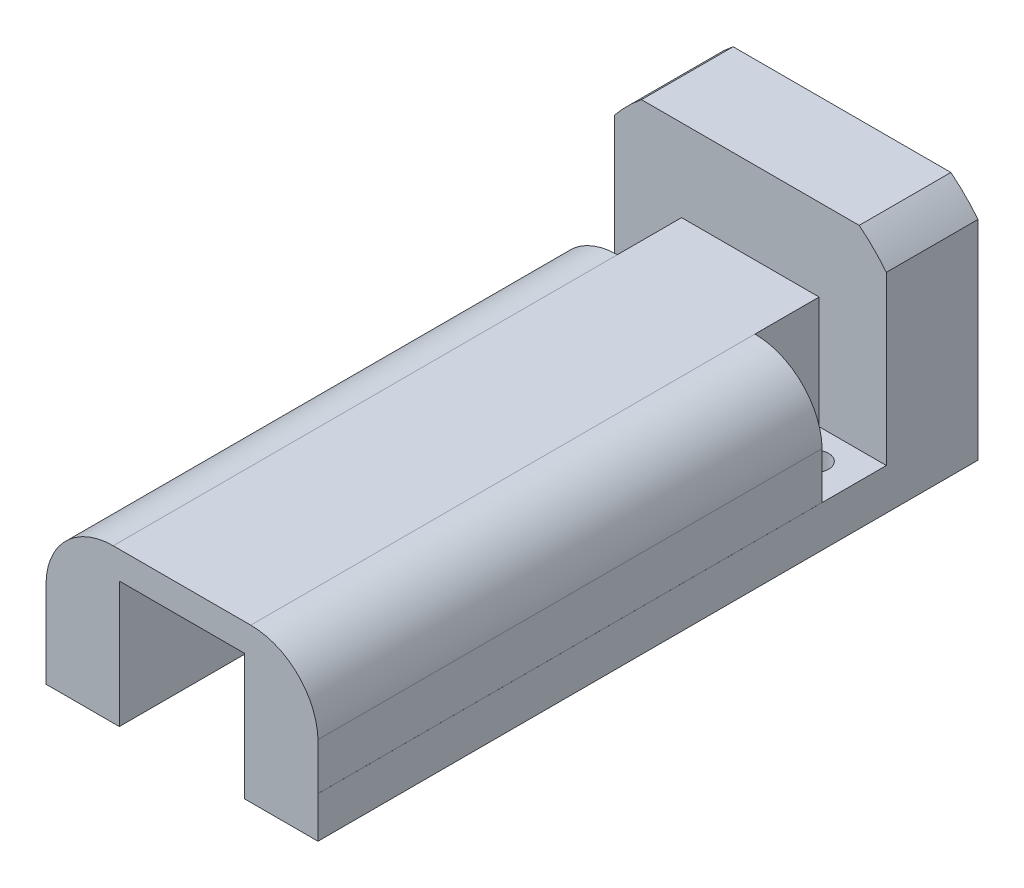
from build123d import *

# Parameters (mm, degrees)
BOSS_EXTRUDE1_DEPTH = 72
BOSS_EXTRUDE3_DEPTH = 5
CUT_EXTRUDE4_DEPTH  = 5
BOSS_EXTRUDE4_DEPTH = 5
BOSS_EXTRUDE5_START = 7
BOSS_EXTRUDE5_DEPTH = 55
CUT_EXTRUDE8_DEPTH  = 5
SKETCH19_W          = 15
SKETCH19_H          = 12.25
BOSS_EXTRUDE8_DEPTH = 7
CUT_EXTRUDE9_REACH  = 78.51
SKETCH20_R          = 1.5
SKETCH21_W          = 23.7
SKETCH21_H          = 22.72285099
CUT_EXTRUDE10_DEPTH = 7
SKETCH24_W          = 13.67
SKETCH24_H          = 10.75
CUT_EXTRUDE13_DEPTH = 65


with BuildPart() as part:
    # Sketch1 → Boss-Extrude1 (new body)
    with BuildSketch(Plane.XY):
        Polygon((-14.835, 0), (-6.835, 0), (-6.835, 3), (6.835, 3), (6.835, 0), (14.835, 0), (14.835, 4.5), (8.35, 4.5), (-8.35, 4.5), (-14.835, 4.5), align=None)
    extrude(amount=-BOSS_EXTRUDE1_DEPTH)

    # Sketch8 → Boss-Extrude3 (add)
    with BuildSketch(Plane(origin=(0, 0, -72), x_dir=(-1, 0, 0), z_dir=(0, 0, -1))):
        Polygon((-14.835, 25.70785099), (-14.835, 0), (-10.35, 0), (-10.35, 21.22285099), (10.35, 21.22285099), (10.35, 0), (14.835, 0), (14.835, 25.70785099), align=None)
    extrude(amount=-BOSS_EXTRUDE3_DEPTH)

    # Sketch9 → Cut-Extrude4 (cut)
    with BuildSketch(Plane(origin=(0, 0, -72), x_dir=(-1, 0, 0), z_dir=(0, 0, -1))):
        with BuildLine():
            Line((-15.009070225, 25.881921215), (-15.009070225, 22.527488279))
            ThreePointArc((-15.009070225, 22.527488279), (-13.436955933, 24.309806923), (-11.654637289, 25.881921215))
            Line((-11.654637289, 25.881921215), (-15.009070225, 25.881921215))
        make_face()
        with BuildLine():
            Line((15.009070225, 25.881921215), (15.009070225, 22.527488279))
            ThreePointArc((15.009070225, 22.527488279), (13.436955933, 24.309806923), (11.654637289, 25.881921215))
            Line((11.654637289, 25.881921215), (15.009070225, 25.881921215))
        make_face()
    extrude(amount=-CUT_EXTRUDE4_DEPTH, mode=Mode.SUBTRACT)

    # Sketch11 → Boss-Extrude4 (add)
    with BuildSketch(Plane.XY.offset(-67)):
        with BuildLine():
            Line((14.835, 4.5), (14.835, 22.748275799))
            ThreePointArc((14.835, 22.748275799), (13.436955933, 24.309806923), (11.875424809, 25.70785099))
            Line((11.875424809, 25.70785099), (-11.875424809, 25.70785099))
            ThreePointArc((-11.875424809, 25.70785099), (-13.436955933, 24.309806923), (-14.835, 22.748275799))
            Line((-14.835, 22.748275799), (-14.835, 4.5))
            Line((-14.835, 4.5), (14.835, 4.5))
        make_face()
    extrude(amount=BOSS_EXTRUDE4_DEPTH)

    # Sketch12 → Boss-Extrude5 (add)
    with BuildSketch(Plane.XY.offset(-62).offset(BOSS_EXTRUDE5_START)):
        with BuildLine():
            Line((-14.835, 4.5), (14.832662348, 4.5))
            Line((14.832662348, 4.5), (14.832662348, 9.600169894))
            ThreePointArc((14.832662348, 9.600169894), (12.620742321, 14.666687642), (7.5, 16.75))
            Line((7.5, 16.75), (-7.5, 16.75))
            ThreePointArc((-7.5, 16.75), (-12.68662824, 14.60162824), (-14.835, 9.415))
            Line((-14.835, 9.415), (-14.835, 4.5))
        make_face()
    extrude(amount=BOSS_EXTRUDE5_DEPTH)

    # Sketch18 → Cut-Extrude8 (cut)
    with BuildSketch(Plane(origin=(0, 0, -72), x_dir=(-1, 0, 0), z_dir=(0, 0, -1))):
        Polygon((-10.35, 4.5), (-10.35, 0), (-6.835, 0), (-6.835, 3), (6.835, 3), (6.835, 0), (10.35, 0), (10.35, 4.5), align=None)
    extrude(amount=-CUT_EXTRUDE8_DEPTH, mode=Mode.SUBTRACT)

    # Sketch19 → Boss-Extrude8 (add)
    with BuildSketch(Plane(origin=(0, 0, -55), x_dir=(-1, 0, 0), z_dir=(0, 0, -1))):
        with Locations((0, 10.625)):
            Rectangle(SKETCH19_W, SKETCH19_H)
    extrude(amount=BOSS_EXTRUDE8_DEPTH)

    # Sketch20 → Cut-Extrude9 (cut, up to next)
    with BuildSketch(Plane(origin=(0, 4.5, 0), x_dir=(1, 0, 0), z_dir=(0, 1, 0)), mode=Mode.PRIVATE) as cut_extrude9_sk1:
        with Locations(Location((-10.5425, 58.5, 0), (0, 0, 180))):
            Circle(SKETCH20_R)
    cut_extrude9_tool1 = extrude(cut_extrude9_sk1.sketch, amount=-CUT_EXTRUDE9_REACH, mode=Mode.PRIVATE) & part.part
    # Sketch20 → Cut-Extrude9 (cut, up to next)
    with BuildSketch(Plane(origin=(0, 4.5, 0), x_dir=(1, 0, 0), z_dir=(0, 1, 0)), mode=Mode.PRIVATE) as cut_extrude9_sk2:
        with Locations(Location((10.5425, 58.5, 0), (0, 0, 270))):
            Circle(SKETCH20_R)
    cut_extrude9_tool2 = extrude(cut_extrude9_sk2.sketch, amount=-CUT_EXTRUDE9_REACH, mode=Mode.PRIVATE) & part.part
    add(cut_extrude9_tool1.solids().sort_by_distance((-10.5425, 4.5, -58.5))[0], mode=Mode.SUBTRACT)
    add(cut_extrude9_tool2.solids().sort_by_distance((10.5425, 4.5, -58.5))[0], mode=Mode.SUBTRACT)

    # Sketch21 → Cut-Extrude10 (cut)
    with BuildSketch(Plane(origin=(0, 0, -72), x_dir=(-1, 0, 0), z_dir=(0, 0, -1))):
        with Locations((0, 11.361425495)):
            Rectangle(SKETCH21_W, SKETCH21_H)
    extrude(amount=-CUT_EXTRUDE10_DEPTH, mode=Mode.SUBTRACT)

    # Sketch24 → Cut-Extrude13 (cut)
    with BuildSketch(Plane.XY):
        with Locations((0, 8.375)):
            Rectangle(SKETCH24_W, SKETCH24_H)
    extrude(amount=-CUT_EXTRUDE13_DEPTH, mode=Mode.SUBTRACT)


solid = part.part
